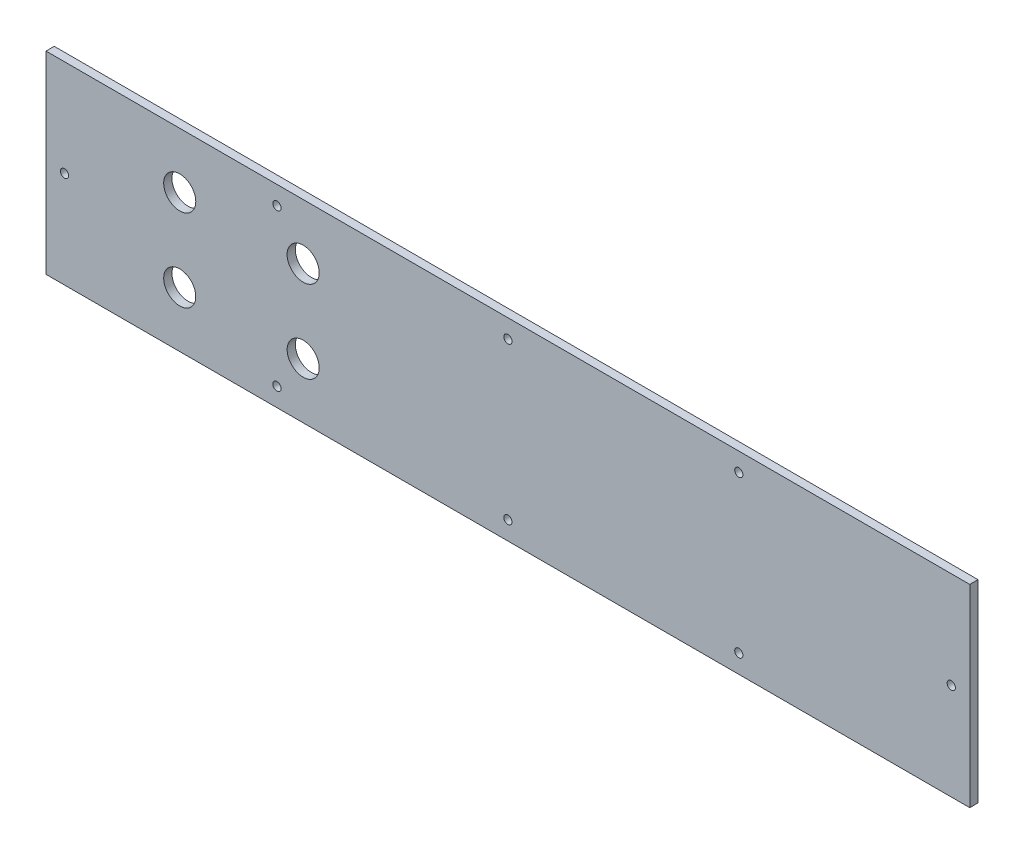
from build123d import *

# Parameters (mm, degrees)
SCHIZZO1_W                   = 449
SCHIZZO1_H                   = 94
SCHIZZO1_R                   = 7.8
SCHIZZO1_R_2                 = 2
ESTRUSIONE_ESTRUSIONE1_DEPTH = 4


with BuildPart() as part:
    # Schizzo1 → Estrusione-Estrusione1 (new body)
    with BuildSketch(Plane.XY):
        with Locations((-224.5, 47)):
            Rectangle(SCHIZZO1_W, SCHIZZO1_H)
        with Locations(Location((-384, 27, 0), (0, 0, 180))):
            Circle(SCHIZZO1_R, mode=Mode.SUBTRACT)
        with Locations((-9, 47)):
            Circle(SCHIZZO1_R_2, mode=Mode.SUBTRACT)
        with Locations((-224.5, 85)):
            Circle(SCHIZZO1_R_2, mode=Mode.SUBTRACT)
        with Locations(Location((-440, 47, 0), (0, 0, 180))):
            Circle(SCHIZZO1_R_2, mode=Mode.SUBTRACT)
        with Locations(Location((-224.5, 9, 0), (0, 0, 180))):
            Circle(SCHIZZO1_R_2, mode=Mode.SUBTRACT)
        with Locations((-324, 27)):
            Circle(SCHIZZO1_R, mode=Mode.SUBTRACT)
        with Locations(Location((-324, 67, 0), (0, 0, 180))):
            Circle(SCHIZZO1_R, mode=Mode.SUBTRACT)
        with Locations((-336.75, 85)):
            Circle(SCHIZZO1_R_2, mode=Mode.SUBTRACT)
        with Locations((-384, 67)):
            Circle(SCHIZZO1_R, mode=Mode.SUBTRACT)
        with Locations(Location((-336.75, 9, 0), (0, 0, 180))):
            Circle(SCHIZZO1_R_2, mode=Mode.SUBTRACT)
        with Locations((-112.25, 9)):
            Circle(SCHIZZO1_R_2, mode=Mode.SUBTRACT)
        with Locations(Location((-112.25, 85, 0), (0, 0, 180))):
            Circle(SCHIZZO1_R_2, mode=Mode.SUBTRACT)
    extrude(amount=ESTRUSIONE_ESTRUSIONE1_DEPTH)


solid = part.part
